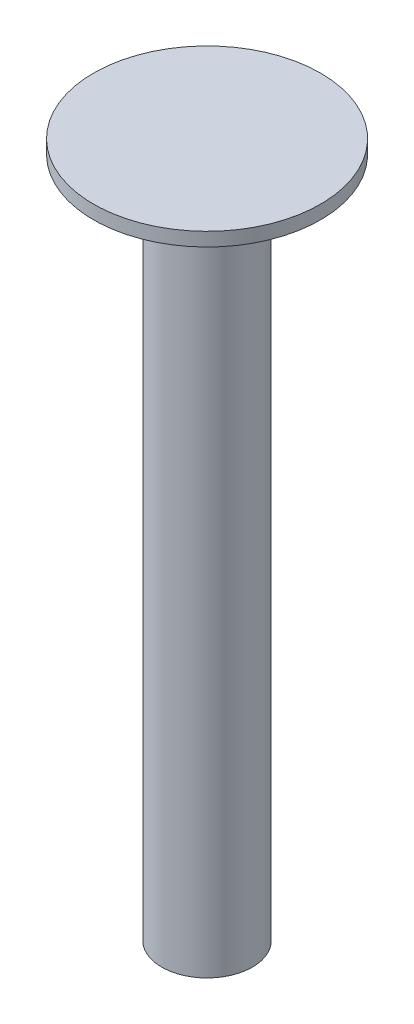
from build123d import *

# Parameters (mm, degrees)
SKETCH1_R           = 5.08
BOSS_EXTRUDE1_DEPTH = 76.2
SKETCH2_R           = 12.7
BOSS_EXTRUDE2_DEPTH = 1.524


with BuildPart() as part:
    # Sketch1 → Boss-Extrude1 (new body)
    with BuildSketch(Plane(origin=(0, 0, 0), x_dir=(1, 0, 0), z_dir=(0, 1, 0))):
        with Locations(Location((0, 0, 0), (0, 0, 90))):
            Circle(SKETCH1_R)
    extrude(amount=BOSS_EXTRUDE1_DEPTH)

    # Sketch2 → Boss-Extrude2 (add)
    with BuildSketch(Plane(origin=(0, 76.2, 0), x_dir=(1, 0, 0), z_dir=(0, 1, 0))):
        with Locations(Location((0, 0, 0), (0, 0, 90))):
            Circle(SKETCH2_R)
    extrude(amount=BOSS_EXTRUDE2_DEPTH)


solid = part.part
